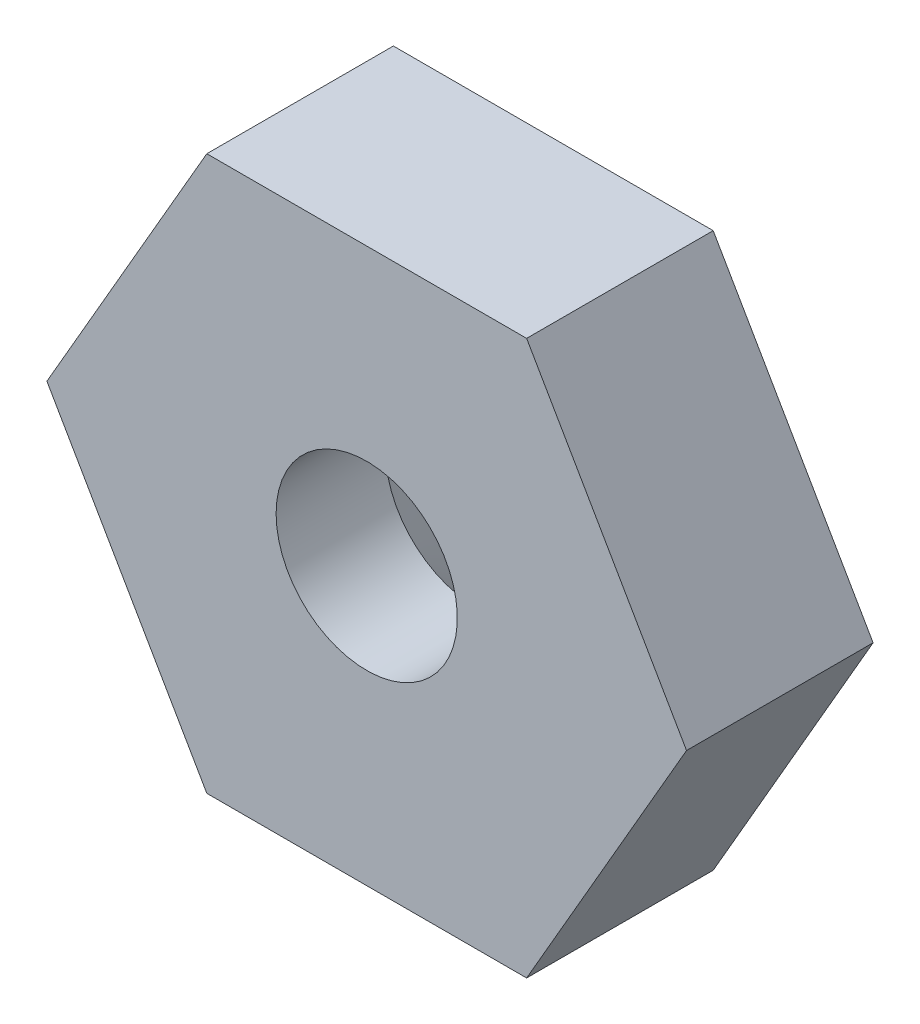
from build123d import *

# Parameters (mm, degrees)
BOSS_EXTRUDE1_DEPTH                                 = 1.75
CSK_FOR_M3_COUNTERSUNK_FLAT_HEAD_SCREW1_D           = 3.4
CSK_FOR_M3_COUNTERSUNK_FLAT_HEAD_SCREW1_DEPTH       = 3.5
CSK_FOR_M3_COUNTERSUNK_FLAT_HEAD_SCREW1_CSINK_D     = 6.3
CSK_FOR_M3_COUNTERSUNK_FLAT_HEAD_SCREW1_CSINK_ANGLE = 90
CSK_FOR_M3_COUNTERSUNK_FLAT_HEAD_SCREW1_TIP         = 1.021463052


with BuildPart() as part:
    # Sketch1 → Boss-Extrude1 (new, symmetric)
    with BuildSketch(Plane.XY):
        Polygon((3, -5.196152423), (6, 0), (3, 5.196152423), (-3, 5.196152423), (-6, 0), (-3, -5.196152423), align=None)
    extrude(amount=BOSS_EXTRUDE1_DEPTH, both=True)

    # CSK for M3 Countersunk Flat Head Screw1
    with Locations(Plane(origin=(0, 0, -1.75), x_dir=(-1, 0, 0), z_dir=(0, 0, -1))):
        with Locations((0, 0)):
            CounterSinkHole(CSK_FOR_M3_COUNTERSUNK_FLAT_HEAD_SCREW1_D / 2, CSK_FOR_M3_COUNTERSUNK_FLAT_HEAD_SCREW1_CSINK_D / 2, depth=CSK_FOR_M3_COUNTERSUNK_FLAT_HEAD_SCREW1_DEPTH, counter_sink_angle=CSK_FOR_M3_COUNTERSUNK_FLAT_HEAD_SCREW1_CSINK_ANGLE)
            with Locations((0, 0, -(CSK_FOR_M3_COUNTERSUNK_FLAT_HEAD_SCREW1_DEPTH + CSK_FOR_M3_COUNTERSUNK_FLAT_HEAD_SCREW1_TIP / 2))):  # 118° drill point
                Cone(0, CSK_FOR_M3_COUNTERSUNK_FLAT_HEAD_SCREW1_D / 2, CSK_FOR_M3_COUNTERSUNK_FLAT_HEAD_SCREW1_TIP, mode=Mode.SUBTRACT)


solid = part.part
